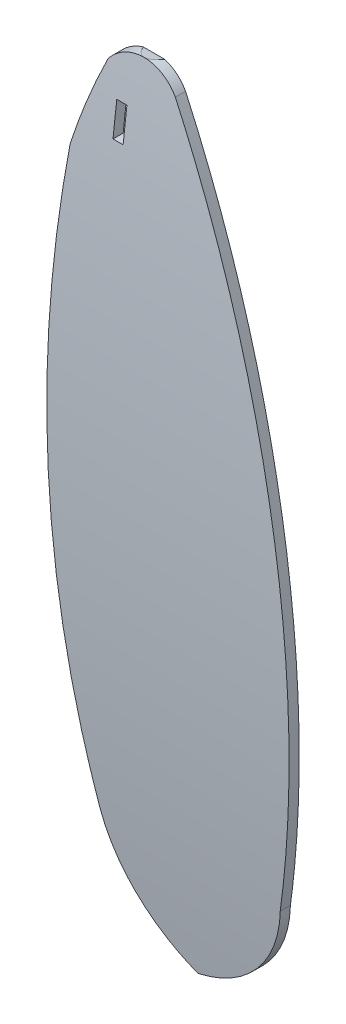
from build123d import *

# Parameters (mm, degrees)
BOSS_EXTRUDE1_DEPTH      = 50.8
BOSS_EXTRUDE1_DEPTH_BACK = 50.8
SKETCH1_W                = 1.524
SKETCH1_H                = 4.871067054
CUT_EXTRUDE1_DEPTH       = 50.8
CUT_EXTRUDE1_DEPTH_BACK  = 50.8
SKETCH2_OUTSIDE_W        = 135.154
SKETCH2_OUTSIDE_H        = 148.693


with BuildPart() as part:
    # Sketch1 → Boss-Extrude1 (new, two sides: drawn at the far end of the back side and taken through both)
    with BuildSketch(Plane.XY.offset(-BOSS_EXTRUDE1_DEPTH_BACK)):
        with BuildLine():
            ThreePointArc((6.741617203, 20.144109787), (1.698900198, 22.631956132), (-3.343816807, 20.144109787))
            ThreePointArc((-3.343816807, 20.144109787), (-5.71730664, 13.971140244), (-7.597975628, 7.630628347))
            ThreePointArc((-7.597975628, 7.630628347), (-8.701431417, -34.535652594), (-3.014754354, -76.331281159))
            ThreePointArc((-3.014754354, -76.331281159), (1.525815948, -85.900303593), (9.804659046, -92.506643425))
            ThreePointArc((9.804659046, -92.506643425), (19.466075818, -86.644924226), (24.084678714, -76.331281159))
            ThreePointArc((24.084678714, -76.331281159), (25.152625845, -26.342752003), (6.741617203, 20.144109787))
        make_face()
        with Locations((-0.762, 13.555168851)):
            Rectangle(SKETCH1_W, SKETCH1_H, mode=Mode.SUBTRACT)
    extrude(amount=BOSS_EXTRUDE1_DEPTH + BOSS_EXTRUDE1_DEPTH_BACK)

    # Sketch2 outside → Cut-Extrude1 (cut, two sides: drawn at the far end of the back side and taken through both)
    with BuildSketch(Plane(origin=(0, 0, 0), x_dir=(0, 0, -1), z_dir=(1, 0, 0)).offset(-CUT_EXTRUDE1_DEPTH_BACK)):
        with Locations((0, -34.9375)):
            Rectangle(SKETCH2_OUTSIDE_W, SKETCH2_OUTSIDE_H)
        with BuildLine():
            Line((1.509494799, 22.422190899), (0, 22.631956132))
            ThreePointArc((0, 22.631956132), (-3.980899399, -34.937343647), (0, -92.506643425))
            Line((0, -92.506643425), (1.509494799, -92.296878192))
            ThreePointArc((1.509494799, -92.296878192), (-2.456899399, -34.937343647), (1.509494799, 22.422190899))
        make_face(mode=Mode.SUBTRACT)
    extrude(amount=CUT_EXTRUDE1_DEPTH + CUT_EXTRUDE1_DEPTH_BACK, mode=Mode.SUBTRACT)


solid = part.part
